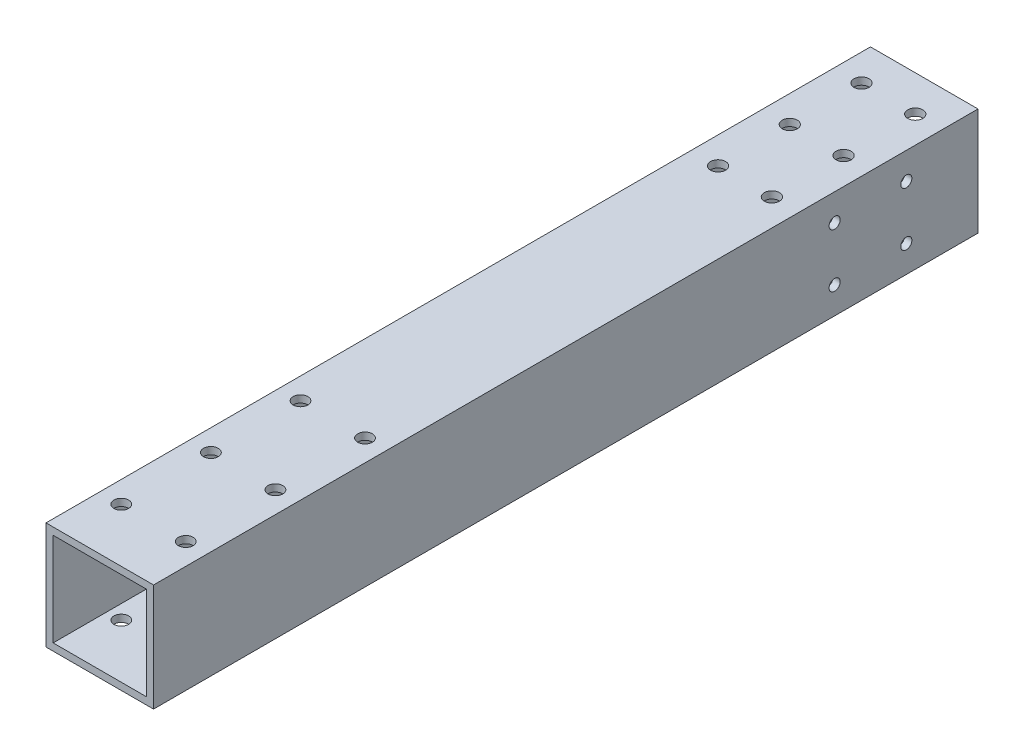
from build123d import *

# Parameters (mm, degrees)
SKETCH_1_W          = 30
SKETCH_1_H          = 30
SKETCH_1_W_2        = 26
SKETCH_1_H_2        = 26
EXTRUDE_1_DEPTH     = 230
SKETCH_2_R          = 2.1
SKETCH_2_R_2        = 2.05
CUT_EXTRUDE_1_DEPTH = 233.432785983
SKETCH_4_R          = 1.55
CUT_EXTRUDE_2_DEPTH = 233.432785983


with BuildPart() as part:
    # 草图1 → 凸台-拉伸1 (new body)
    with BuildSketch(Plane.XY):
        Rectangle(SKETCH_1_W, SKETCH_1_H)
        Rectangle(SKETCH_1_W_2, SKETCH_1_H_2, mode=Mode.SUBTRACT)
    extrude(amount=EXTRUDE_1_DEPTH)

    # 草图2 → 切除-拉伸1 (cut, through all)
    with BuildSketch(Plane.XZ.offset(15)):
        with Locations(Location((-7.5, 10, 0), (0, 0, 270))):
            Circle(SKETCH_2_R)
        with Locations(Location((7.5, 10, 0), (0, 0, 270))):
            Circle(SKETCH_2_R)
        with Locations(Location((7.5, 30, 0), (0, 0, 270))):
            Circle(SKETCH_2_R)
        with Locations(Location((7.5, 50, 0), (0, 0, 270))):
            Circle(SKETCH_2_R)
        with Locations(Location((-7.5, 30, 0), (0, 0, 270))):
            Circle(SKETCH_2_R)
        with Locations(Location((-7.5, 50, 0), (0, 0, 270))):
            Circle(SKETCH_2_R)
        with Locations(Location((-9, 215, 0), (0, 0, 270))):
            Circle(SKETCH_2_R_2)
        with Locations(Location((9, 215, 0), (0, 0, 270))):
            Circle(SKETCH_2_R_2)
        with Locations(Location((9, 190, 0), (0, 0, 270))):
            Circle(SKETCH_2_R_2)
        with Locations(Location((9, 165, 0), (0, 0, 270))):
            Circle(SKETCH_2_R_2)
        with Locations(Location((-9, 190, 0), (0, 0, 270))):
            Circle(SKETCH_2_R_2)
        with Locations(Location((-9, 165, 0), (0, 0, 270))):
            Circle(SKETCH_2_R_2)
    extrude(amount=-CUT_EXTRUDE_1_DEPTH, mode=Mode.SUBTRACT)

    # 草图4 → 切除-拉伸2 (cut, through all)
    with BuildSketch(Plane(origin=(15, 0, 0), x_dir=(0, 0, -1), z_dir=(1, 0, 0))):
        with Locations((-20, 7.5)):
            Circle(SKETCH_4_R)
        with Locations((-40, 7.5)):
            Circle(SKETCH_4_R)
        with Locations((-40, -7.5)):
            Circle(SKETCH_4_R)
        with Locations((-20, -7.5)):
            Circle(SKETCH_4_R)
    extrude(amount=-CUT_EXTRUDE_2_DEPTH, mode=Mode.SUBTRACT)


solid = part.part
